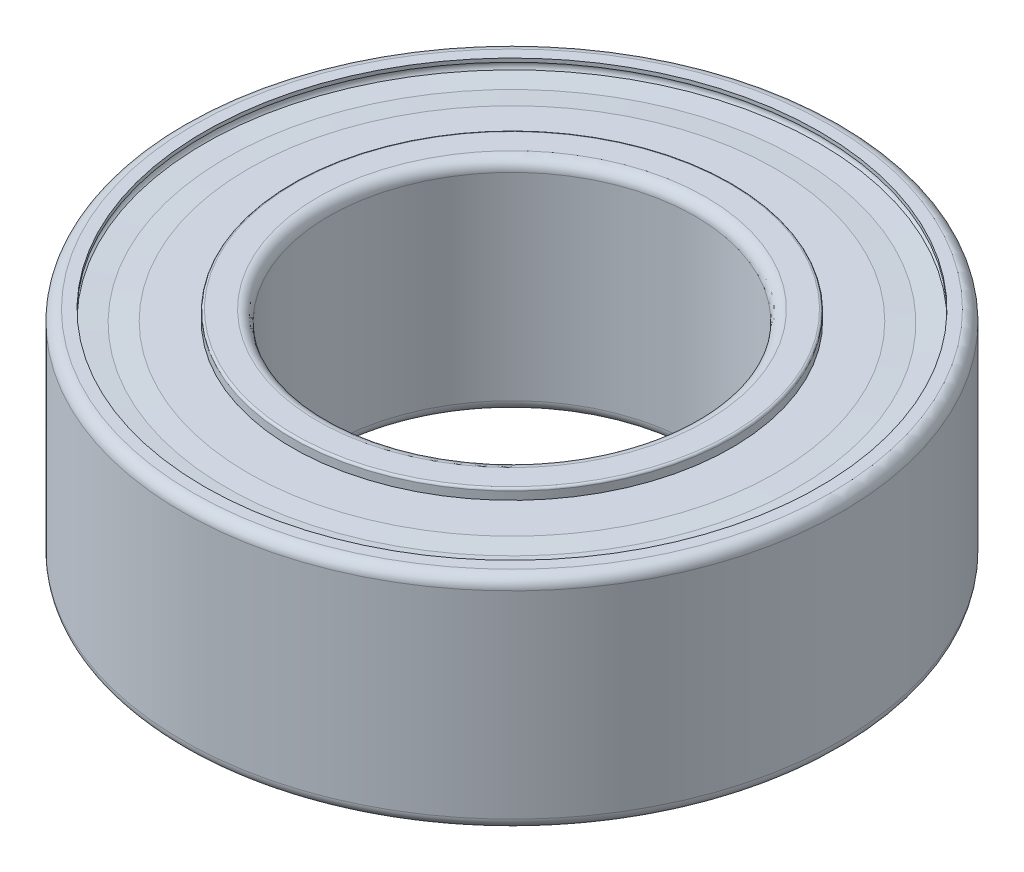
from build123d import *

# Parameters (mm, degrees)
KRUHOV_POLE1_COUNT = 8


with BuildPart() as part:
    # Skica4 → Rotovat2 (revolve)
    with BuildSketch(Plane.XY, mode=Mode.PRIVATE) as rotovat2_sk:
        with BuildLine():
            Line((4.5, 1.35), (4.5, -1.35))
            ThreePointArc((4.5, -1.35), (4.456066017, -1.456066017), (4.35, -1.5))
            Line((4.35, -1.5), (4.2, -1.5))
            Line((4.2, -1.5), (4.2, -1.45))
            ThreePointArc((4.2, -1.45), (4.289757174, -1.366606789), (4.213177928, -1.270969993))
            Line((4.213177928, -1.270969993), (3.85, -1.217213595))
            Line((3.85, -1.217213595), (3.85, -0.447213595))
            ThreePointArc((3.85, -0.447213595), (4.05, 0), (3.85, 0.447213595))
            Line((3.85, 0.447213595), (3.85, 1.217213595))
            Line((3.85, 1.217213595), (4.213177928, 1.270969993))
            ThreePointArc((4.213177928, 1.270969993), (4.289757174, 1.366606789), (4.2, 1.45))
            Line((4.2, 1.45), (4.2, 1.5))
            Line((4.2, 1.5), (4.35, 1.5))
            ThreePointArc((4.35, 1.5), (4.456066017, 1.456066017), (4.5, 1.35))
        make_face()
    revolve(rotovat2_sk.sketch.rotate(Axis((0, 0, 0), (0, 1, 0)), 90), axis=Axis((0, 0, 0), (0, 1, 0)))


with BuildPart() as body_2:
    # Skica5 → Rotovat3 (revolve)
    with BuildSketch(Plane.XY, mode=Mode.PRIVATE) as rotovat3_sk:
        with BuildLine():
            Line((2.5, 1.35), (2.5, -1.35))
            ThreePointArc((2.5, -1.35), (2.543933983, -1.456066017), (2.65, -1.5))
            Line((2.65, -1.5), (2.97, -1.5))
            ThreePointArc((2.97, -1.5), (2.991213203, -1.491213203), (3, -1.47))
            Line((3, -1.47), (3, -1.36))
            Line((3, -1.36), (3.6, -1.36))
            Line((3.6, -1.36), (3.896185034, -1.308285153))
            Line((3.896185034, -1.308285153), (4.192370069, -1.36))
            Line((4.192370069, -1.36), (4.192370069, -1.31))
            Line((4.192370069, -1.31), (3.897467562, -1.241937442))
            Line((3.897467562, -1.241937442), (3.597467562, -1.241937442))
            Line((3.597467562, -1.241937442), (3, -1.31))
            Line((3, -1.31), (3, -0.396862697))
            ThreePointArc((3, -0.396862697), (2.85, 0), (3, 0.396862697))
            Line((3, 0.396862697), (3, 1.31))
            Line((3, 1.31), (3.6, 1.27))
            Line((3.6, 1.27), (3.9, 1.27))
            Line((3.9, 1.27), (4.2, 1.31))
            Line((4.2, 1.31), (4.2, 1.36))
            Line((4.2, 1.36), (3.9, 1.34))
            Line((3.9, 1.34), (3.6, 1.36))
            Line((3.6, 1.36), (3, 1.36))
            Line((3, 1.36), (3, 1.47))
            ThreePointArc((3, 1.47), (2.991213203, 1.491213203), (2.97, 1.5))
            Line((2.97, 1.5), (2.65, 1.5))
            ThreePointArc((2.65, 1.5), (2.543933983, 1.456066017), (2.5, 1.35))
        make_face()
    revolve(rotovat3_sk.sketch.rotate(Axis((0, 0, 0), (0, 1, 0)), 90), axis=Axis((0, 0, 0), (0, 1, 0)))


with BuildPart() as body_3:
    # Skica6 → Rotovat4 (revolve)
    with BuildSketch(Plane.XY):
        with BuildLine():
            Line((3.45, 0.6), (3.45, -0.6))
            ThreePointArc((3.45, -0.6), (4.05, 0), (3.45, 0.6))
        make_face()
    revolve(axis=Axis((3.45, 0.6, 0), (0, -1, 0)))


with BuildPart() as kruhov_pole1_1:
    # Kruhové pole1: pattern copy
    add(body_3.part.rotate(Axis((0, 0, 0), (0, 1, 0)), 1 * 360 / KRUHOV_POLE1_COUNT))


with BuildPart() as kruhov_pole1_2:
    # Kruhové pole1: pattern copy
    add(body_3.part.rotate(Axis((0, 0, 0), (0, 1, 0)), 2 * 360 / KRUHOV_POLE1_COUNT))


with BuildPart() as kruhov_pole1_3:
    # Kruhové pole1: pattern copy
    add(body_3.part.rotate(Axis((0, 0, 0), (0, 1, 0)), 3 * 360 / KRUHOV_POLE1_COUNT))


with BuildPart() as kruhov_pole1_4:
    # Kruhové pole1: pattern copy
    add(body_3.part.rotate(Axis((0, 0, 0), (0, 1, 0)), 4 * 360 / KRUHOV_POLE1_COUNT))


with BuildPart() as kruhov_pole1_5:
    # Kruhové pole1: pattern copy
    add(body_3.part.rotate(Axis((0, 0, 0), (0, 1, 0)), 5 * 360 / KRUHOV_POLE1_COUNT))


with BuildPart() as kruhov_pole1_6:
    # Kruhové pole1: pattern copy
    add(body_3.part.rotate(Axis((0, 0, 0), (0, 1, 0)), 6 * 360 / KRUHOV_POLE1_COUNT))


with BuildPart() as kruhov_pole1_7:
    # Kruhové pole1: pattern copy
    add(body_3.part.rotate(Axis((0, 0, 0), (0, 1, 0)), 7 * 360 / KRUHOV_POLE1_COUNT))


solid = Compound([part.part, body_2.part, body_3.part, kruhov_pole1_1.part, kruhov_pole1_2.part, kruhov_pole1_3.part, kruhov_pole1_4.part, kruhov_pole1_5.part, kruhov_pole1_6.part, kruhov_pole1_7.part])
